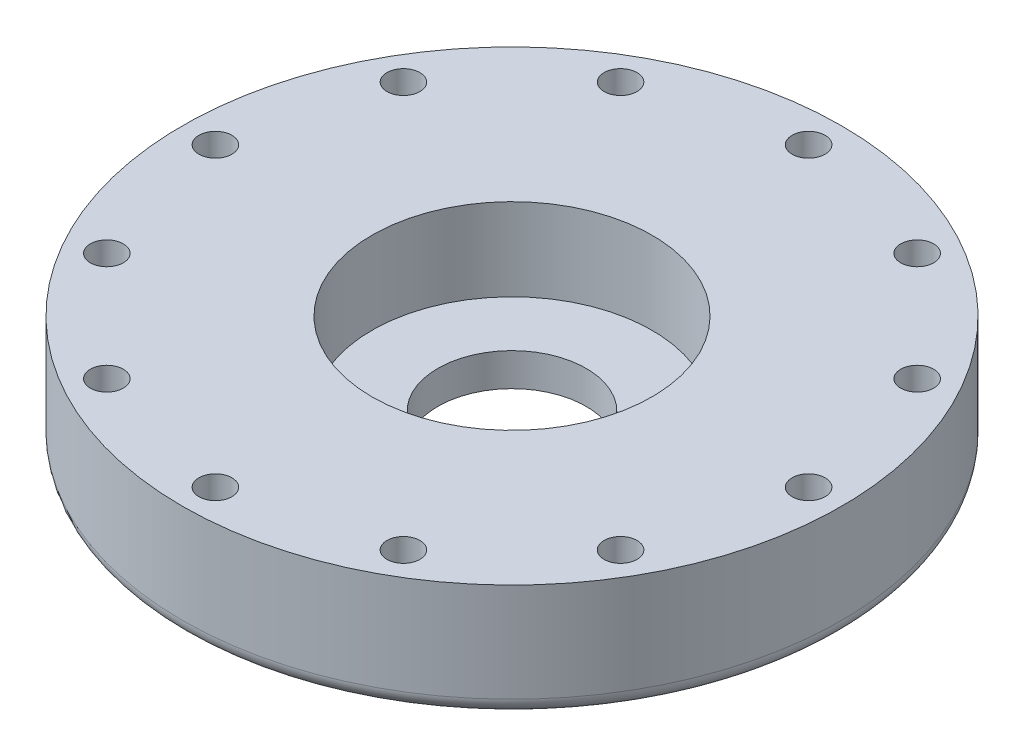
from build123d import *

# Parameters (mm, degrees)
SKETCH1_R           = 20
BOSS_EXTRUDE1_DEPTH = 7
SKETCH2_R           = 8.5
CUT_EXTRUDE1_DEPTH  = 5
SKETCH3_R           = 4.5
CUT_EXTRUDE2_DEPTH  = 29.722813233
SKETCH4_R           = 1
CUT_EXTRUDE3_DEPTH  = 5
FILLET1_R           = 1


with BuildPart() as part:
    # Sketch1 → Boss-Extrude1 (new body)
    with BuildSketch(Plane(origin=(0, 0, 0), x_dir=(1, 0, 0), z_dir=(0, 1, 0))):
        with Locations(Location((0, 0, 0), (0, 0, 270))):
            Circle(SKETCH1_R)
    extrude(amount=BOSS_EXTRUDE1_DEPTH)

    # Sketch2 → Cut-Extrude1 (cut)
    with BuildSketch(Plane(origin=(0, 7, 0), x_dir=(1, 0, 0), z_dir=(0, 1, 0))):
        with Locations(Location((0, 0, 0), (0, 0, 270))):
            Circle(SKETCH2_R)
    extrude(amount=-CUT_EXTRUDE1_DEPTH, mode=Mode.SUBTRACT)

    # Sketch3 → Cut-Extrude2 (cut, through all)
    with BuildSketch(Plane(origin=(0, 2, 0), x_dir=(1, 0, 0), z_dir=(0, 1, 0))):
        with Locations(Location((0, 0, 0), (0, 0, 270))):
            Circle(SKETCH3_R)
    extrude(amount=-CUT_EXTRUDE2_DEPTH, mode=Mode.SUBTRACT)

    # Sketch4 → Cut-Extrude3 (cut)
    with BuildSketch(Plane(origin=(0, 7, 0), x_dir=(1, 0, 0), z_dir=(0, 1, 0))):
        with Locations(Location((0, 18, 0), (0, 0, 270))):
            Circle(SKETCH4_R)
        with Locations(Location((9, 15.588457268, 0), (0, 0, 270))):
            Circle(SKETCH4_R)
        with Locations(Location((15.588457268, 9, 0), (0, 0, 270))):
            Circle(SKETCH4_R)
        with Locations(Location((18, 0, 0), (0, 0, 270))):
            Circle(SKETCH4_R)
        with Locations(Location((15.588457268, -9, 0), (0, 0, 270))):
            Circle(SKETCH4_R)
        with Locations(Location((9, -15.588457268, 0), (0, 0, 270))):
            Circle(SKETCH4_R)
        with Locations(Location((0, -18, 0), (0, 0, 270))):
            Circle(SKETCH4_R)
        with Locations(Location((-9, -15.588457268, 0), (0, 0, 270))):
            Circle(SKETCH4_R)
        with Locations(Location((-15.588457268, -9, 0), (0, 0, 270))):
            Circle(SKETCH4_R)
        with Locations(Location((-18, 0, 0), (0, 0, 270))):
            Circle(SKETCH4_R)
        with Locations(Location((-15.588457268, 9, 0), (0, 0, 270))):
            Circle(SKETCH4_R)
        with Locations(Location((-9, 15.588457268, 0), (0, 0, 270))):
            Circle(SKETCH4_R)
    extrude(amount=-CUT_EXTRUDE3_DEPTH, mode=Mode.SUBTRACT)

    # Fillet1
    fillet1_edges = [part.edges().sort_by_distance(p)[0] for p in [
        (0, 0, -20),
    ]]
    fillet(fillet1_edges, radius=FILLET1_R)


solid = part.part
